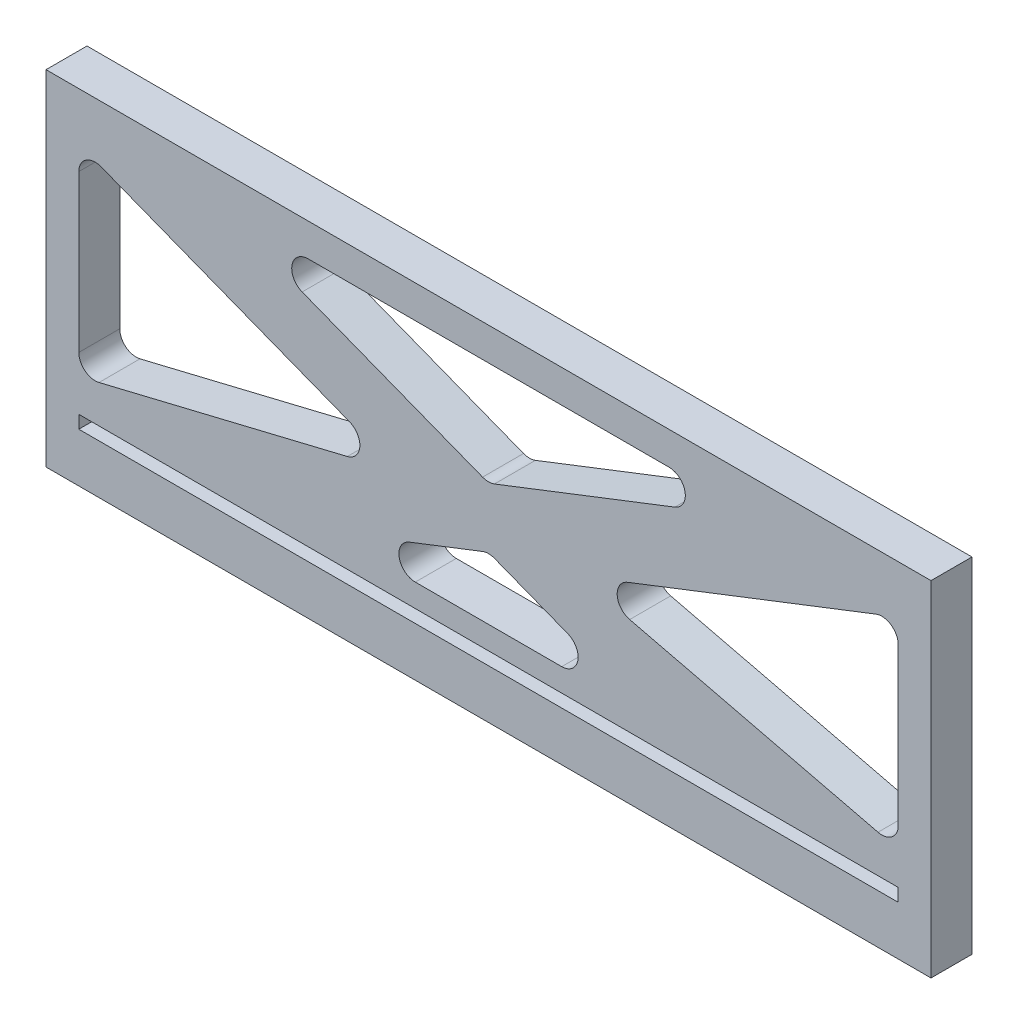
from build123d import *

# Parameters (mm, degrees)
SKETCH1_W           = 68.58
SKETCH1_H           = 26.67
SKETCH1_W_2         = 63.5
SKETCH1_H_2         = 1
BOSS_EXTRUDE1_DEPTH = 3.175
FILLET1_R           = 1.27


with BuildPart() as part:
    # Sketch1 → Boss-Extrude1 (new body)
    with BuildSketch(Plane.XY):
        Rectangle(SKETCH1_W, SKETCH1_H)
        Polygon((-20.750635985, 10.795), (0, 2.725308228), (20.750635985, 10.795), align=None, mode=Mode.SUBTRACT)
        with Locations((0, -9.025)):
            Rectangle(SKETCH1_W_2, SKETCH1_H_2, mode=Mode.SUBTRACT)
        Polygon((-31.75, 9.621913994), (-31.75, -5.985), (-7.007935444, 0), align=None, mode=Mode.SUBTRACT)
        Polygon((7.007935444, 0), (31.75, 9.621913994), (31.75, -5.985), align=None, mode=Mode.SUBTRACT)
        Polygon((0, -1.90771576), (-12.443873761, -6.747), (12.443873761, -6.747), align=None, mode=Mode.SUBTRACT)
    extrude(amount=BOSS_EXTRUDE1_DEPTH)

    # Fillet1
    fillet1_edges = [part.edges().sort_by_distance(p)[0] for p in [
        (20.750635985, 10.795, 1.5875),
        (-20.750635985, 10.795, 1.5875),
        (0, 2.725308228, 1.5875),
        (-7.007935444, 0, 1.5875),
        (-31.75, 9.621913994, 1.5875),
        (-31.75, -5.985, 1.5875),
        (7.007935444, 0, 1.5875),
        (31.75, -5.985, 1.5875),
        (31.75, 9.621913994, 1.5875),
        (12.443873761, -6.747, 1.5875),
        (0, -1.90771576, 1.5875),
        (-12.443873761, -6.747, 1.5875),
    ]]
    fillet(fillet1_edges, radius=FILLET1_R)


solid = part.part
